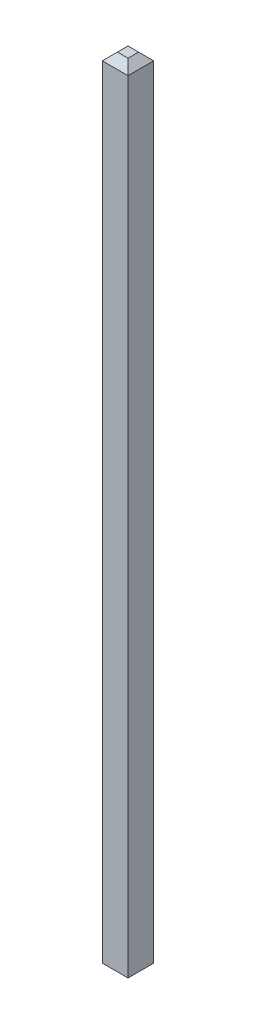
from build123d import *

# Parameters (mm, degrees)
SKETCH2_W           = 0.68
SKETCH2_H           = 0.68
BOSS_EXTRUDE1_DEPTH = 21.08
CHAMFER1_SIZE       = 0.2


with BuildPart() as part:
    # Sketch2 → Boss-Extrude1 (new body)
    with BuildSketch(Plane(origin=(0, 0, 0), x_dir=(1, 0, 0), z_dir=(0, 1, 0))):
        Rectangle(SKETCH2_W, SKETCH2_H)
    extrude(amount=BOSS_EXTRUDE1_DEPTH)

    # Chamfer1
    chamfer1_edges = [part.edges().sort_by_distance(p)[0] for p in [
        (-0.34, 21.08, 0),
        (0, 21.08, 0.34),
        (0.34, 21.08, 0),
        (0, 0, 0.34),
        (-0.34, 0, 0),
        (0, 0, -0.34),
        (0.34, 0, 0),
        (0, 21.08, -0.34),
    ]]
    chamfer(chamfer1_edges, length=CHAMFER1_SIZE)


solid = part.part
